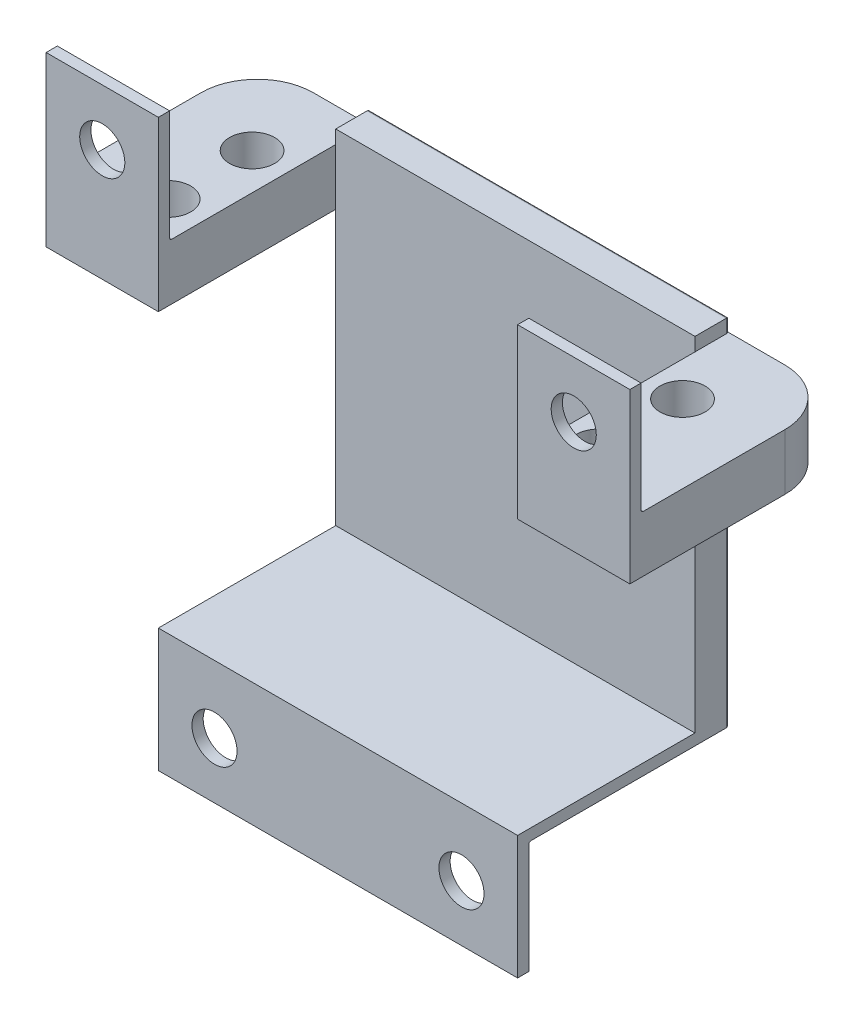
from build123d import *

# Parameters (mm, degrees)
SKETCH1_W            = 12.7
SKETCH1_H            = 18.796
BOSS_EXTRUDE1_DEPTH  = 6.35
SKETCH2_R            = 2.5527
CUT_EXTRUDE1_DEPTH   = 6.35
SKETCH3_W            = 66.04
SKETCH3_H            = 6.35
BOSS_EXTRUDE2_DEPTH  = 5.08
SKETCH4_W            = 40.64
SKETCH4_H            = 1.524
BOSS_EXTRUDE5_DEPTH  = 3.81
SKETCH9_W            = 40.64
SKETCH9_H            = 30.988
BOSS_EXTRUDE6_DEPTH  = 3.81
SKETCH10_W           = 53.34
SKETCH10_H           = 6.35
CUT_EXTRUDE3_DEPTH   = 1.27
SKETCH11_W           = 12.7
SKETCH11_H           = 19.05
BOSS_EXTRUDE7_DEPTH  = 1.27
SKETCH16_R           = 2.5527
CUT_EXTRUDE5_DEPTH   = 1.27
SKETCH17_W           = 12.7
SKETCH17_H           = 6.35
BOSS_EXTRUDE8_DEPTH  = 23.876
SKETCH20_R           = 2.5527
CUT_EXTRUDE6_DEPTH   = 6.35
SKETCH21_W           = 12.7
SKETCH21_H           = 19.05
BOSS_EXTRUDE9_DEPTH  = 1.27
SKETCH22_R           = 2.5527
CUT_EXTRUDE7_DEPTH   = 1.27
SKETCH23_W           = 40.64
SKETCH23_H           = 23.876
BOSS_EXTRUDE10_DEPTH = 1.27
SKETCH24_W           = 40.64
SKETCH24_H           = 13.97
BOSS_EXTRUDE11_DEPTH = 1.27
SKETCH25_R           = 2.5527
CUT_EXTRUDE8_DEPTH   = 1.27
FILLET4_R            = 6.35
FILLET5_R            = 0.254


with BuildPart() as part:
    # Sketch1 → Boss-Extrude1 (new body)
    with BuildSketch(Plane(origin=(0, 0, 0), x_dir=(1, 0, 0), z_dir=(0, 1, 0))):
        with Locations((6.35, 9.398)):
            Rectangle(SKETCH1_W, SKETCH1_H)
    extrude(amount=BOSS_EXTRUDE1_DEPTH)

    # Sketch2 → Cut-Extrude1 (cut)
    with BuildSketch(Plane(origin=(0, 6.35, 0), x_dir=(1, 0, 0), z_dir=(0, 1, 0))):
        with Locations(Location((8.552562419, 14.75, 0), (0, 0, 270))):
            Circle(SKETCH2_R)
        with Locations(Location((8.552562419, 5.25, 0), (0, 0, 270))):
            Circle(SKETCH2_R)
    extrude(amount=-CUT_EXTRUDE1_DEPTH, mode=Mode.SUBTRACT)

    # Sketch3 → Boss-Extrude2 (add)
    with BuildSketch(Plane(origin=(0, 0, -18.796), x_dir=(-1, 0, 0), z_dir=(0, 0, -1))):
        with Locations((-33.02, 3.175)):
            Rectangle(SKETCH3_W, SKETCH3_H)
    extrude(amount=BOSS_EXTRUDE2_DEPTH)

    # Sketch4 → Boss-Extrude5 (add)
    with BuildSketch(Plane(origin=(0, 0, -23.876), x_dir=(-1, 0, 0), z_dir=(0, 0, -1))):
        with Locations((-33.02, 7.112)):
            Rectangle(SKETCH4_W, SKETCH4_H)
    extrude(amount=-BOSS_EXTRUDE5_DEPTH)

    # Sketch9 → Boss-Extrude6 (add)
    with BuildSketch(Plane(origin=(0, 0, -23.876), x_dir=(-1, 0, 0), z_dir=(0, 0, -1))):
        with Locations((-33.02, -15.494)):
            Rectangle(SKETCH9_W, SKETCH9_H)
    extrude(amount=-BOSS_EXTRUDE6_DEPTH)

    # Sketch10 → Cut-Extrude3 (cut)
    with BuildSketch(Plane.XY.offset(-18.796)):
        with Locations((39.37, 3.175)):
            Rectangle(SKETCH10_W, SKETCH10_H)
    extrude(amount=-CUT_EXTRUDE3_DEPTH, mode=Mode.SUBTRACT)

    # Sketch11 → Boss-Extrude7 (add)
    with BuildSketch(Plane.XY):
        with Locations((6.35, 9.525)):
            Rectangle(SKETCH11_W, SKETCH11_H)
    extrude(amount=-BOSS_EXTRUDE7_DEPTH)

    # Sketch16 → Cut-Extrude5 (cut)
    with BuildSketch(Plane(origin=(0, 0, -1.27), x_dir=(-1, 0, 0), z_dir=(0, 0, -1))):
        with Locations((-6.35, 12.7)):
            Circle(SKETCH16_R)
    extrude(amount=-CUT_EXTRUDE5_DEPTH, mode=Mode.SUBTRACT)

    # Sketch17 → Boss-Extrude8 (add)
    with BuildSketch(Plane(origin=(0, 0, -23.876), x_dir=(-1, 0, 0), z_dir=(0, 0, -1))):
        with Locations((-59.69, 3.175)):
            Rectangle(SKETCH17_W, SKETCH17_H)
    extrude(amount=-BOSS_EXTRUDE8_DEPTH)

    # Sketch20 → Cut-Extrude6 (cut)
    with BuildSketch(Plane(origin=(0, 6.35, 0), x_dir=(1, 0, 0), z_dir=(0, 1, 0))):
        with Locations(Location((57.247437581, 14.75, 0), (0, 0, 270))):
            Circle(SKETCH20_R)
        with Locations(Location((57.247437581, 5.25, 0), (0, 0, 270))):
            Circle(SKETCH20_R)
    extrude(amount=-CUT_EXTRUDE6_DEPTH, mode=Mode.SUBTRACT)

    # Sketch21 → Boss-Extrude9 (add)
    with BuildSketch(Plane.XY):
        with Locations((59.69, 9.525)):
            Rectangle(SKETCH21_W, SKETCH21_H)
    extrude(amount=-BOSS_EXTRUDE9_DEPTH)

    # Sketch22 → Cut-Extrude7 (cut)
    with BuildSketch(Plane(origin=(0, 0, -1.27), x_dir=(-1, 0, 0), z_dir=(0, 0, -1))):
        with Locations((-59.69, 12.7)):
            Circle(SKETCH22_R)
    extrude(amount=-CUT_EXTRUDE7_DEPTH, mode=Mode.SUBTRACT)

    # Sketch23 → Boss-Extrude10 (add)
    with BuildSketch(Plane.XZ.offset(30.988)):
        with Locations((33.02, -11.938)):
            Rectangle(SKETCH23_W, SKETCH23_H)
    extrude(amount=BOSS_EXTRUDE10_DEPTH)

    # Sketch24 → Boss-Extrude11 (add)
    with BuildSketch(Plane.XY):
        with Locations((33.02, -37.973)):
            Rectangle(SKETCH24_W, SKETCH24_H)
    extrude(amount=-BOSS_EXTRUDE11_DEPTH)

    # Sketch25 → Cut-Extrude8 (cut)
    with BuildSketch(Plane(origin=(0, 0, -1.27), x_dir=(-1, 0, 0), z_dir=(0, 0, -1))):
        with Locations((-46.99, -38.608)):
            Circle(SKETCH25_R)
        with Locations((-19.05, -38.608)):
            Circle(SKETCH25_R)
    extrude(amount=-CUT_EXTRUDE8_DEPTH, mode=Mode.SUBTRACT)

    # Fillet4
    fillet4_edges = [part.edges().sort_by_distance(p)[0] for p in [
        (0, 3.175, -23.876),
        (66.04, 3.175, -23.876),
    ]]
    fillet(fillet4_edges, radius=FILLET4_R)

    # Fillet5
    fillet5_edges = [part.edges().sort_by_distance(p)[0] for p in [
        (59.69, 6.35, -1.27),
        (33.02, -32.258, -23.876),
        (33.02, -32.258, -1.27),
        (53.34, 7.112, -23.876),
        (12.7, 7.112, -23.876),
        (33.02, 7.874, -23.876),
        (12.7, -16.129, -23.876),
        (53.34, -16.129, -23.876),
        (6.35, 6.35, -1.27),
    ]]
    fillet(fillet5_edges, radius=FILLET5_R)


solid = part.part
